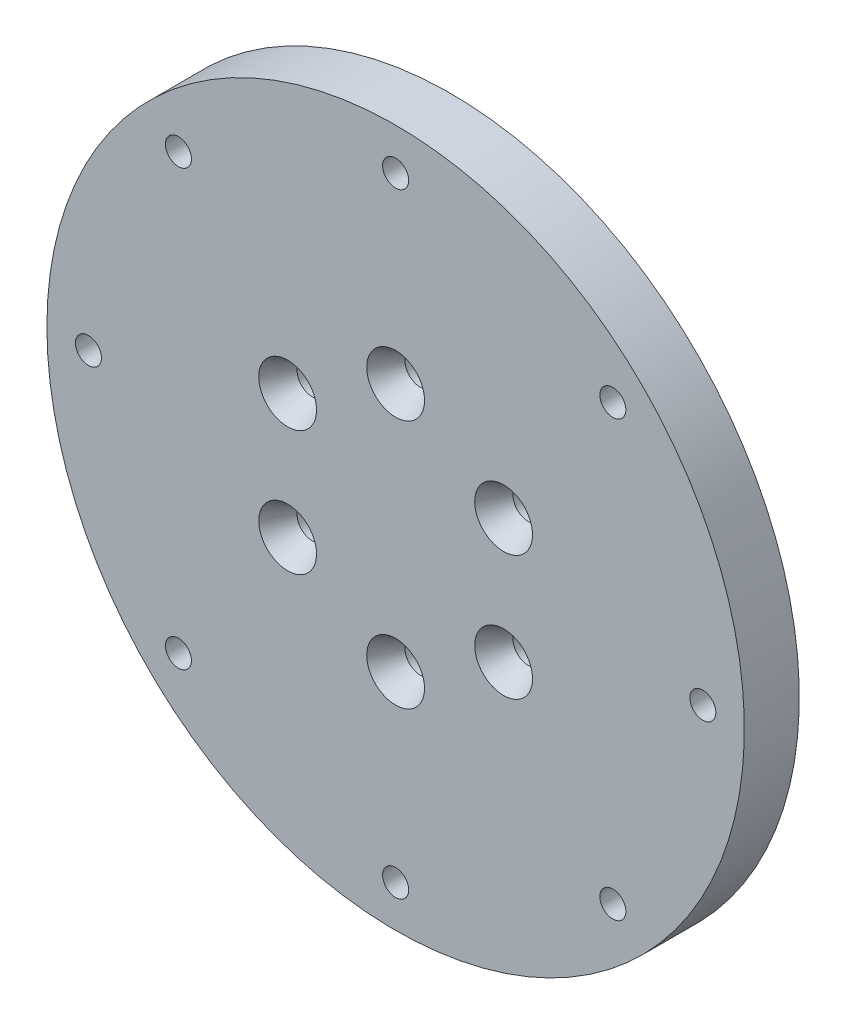
from build123d import *

# Parameters (mm, degrees)
SKETCH_1_R               = 29.5
EXTRUDE_1_DEPTH          = 12
SKETCH_2_R               = 48.25
EXTRUDE_2_DEPTH          = 7.6
FILLET_1_R               = 5
SKETCH_4_R               = 3
CUT_EXTRUDE_1_DEPTH      = 3.6
SKETCH_5_R               = 2.1
CUT_EXTRUDE_2_DEPTH      = 45.6
PATTERN_CIRCULAR_1_COUNT = 6
SKETCH_7_R               = 1.8
CUT_EXTRUDE_3_DEPTH      = 45.6


with BuildPart() as part:
    # 草图1 → 凸台-拉伸1 (new body)
    with BuildSketch(Plane.XY):
        Circle(SKETCH_1_R)
    extrude(amount=EXTRUDE_1_DEPTH)

    # 草图2 → 凸台-拉伸2 (add)
    with BuildSketch(Plane.XY.offset(12)):
        Circle(SKETCH_2_R)
    extrude(amount=EXTRUDE_2_DEPTH)

    # 圆角1
    fillet_1_edges = [part.edges().sort_by_distance(p)[0] for p in [
        (-29.5, 0, 12),
    ]]
    fillet(fillet_1_edges, radius=FILLET_1_R)

    # 草图4 → 切除-拉伸1 (cut)
    with BuildSketch(Plane(origin=(0, 0, 12), x_dir=(-1, 0, 0), z_dir=(0, 0, -1))):
        with Locations((0, 42.5)):
            Circle(SKETCH_4_R)
        with Locations((30.0520382, 30.0520382)):
            Circle(SKETCH_4_R)
        with Locations((42.5, 0)):
            Circle(SKETCH_4_R)
        with Locations((30.0520382, -30.0520382)):
            Circle(SKETCH_4_R)
        with Locations((0, -42.5)):
            Circle(SKETCH_4_R)
        with Locations((-30.0520382, -30.0520382)):
            Circle(SKETCH_4_R)
        with Locations((-42.5, 0)):
            Circle(SKETCH_4_R)
        with Locations((-30.0520382, 30.0520382)):
            Circle(SKETCH_4_R)
    extrude(amount=-CUT_EXTRUDE_1_DEPTH, mode=Mode.SUBTRACT)

    # 草图5 → 切除-拉伸2 (cut)
    with BuildSketch(Plane.XY.offset(19.6)):
        with Locations((14.938938215, 8.625)):
            Circle(SKETCH_5_R)
        with Locations((14.938938215, -8.625)):
            Circle(SKETCH_5_R)
        with Locations((0, 17.25)):
            Circle(SKETCH_5_R)
        with Locations((0, -17.25)):
            Circle(SKETCH_5_R)
        with Locations((-14.938938215, 8.625)):
            Circle(SKETCH_5_R)
        with Locations((-14.938938215, -8.625)):
            Circle(SKETCH_5_R)
    extrude(amount=-CUT_EXTRUDE_2_DEPTH, mode=Mode.SUBTRACT)

    # 草图6 → 切除-旋转1 (revolve, cut)
    with BuildSketch(Plane(origin=(7.469469108, 12.9375, 0), x_dir=(0.8660254037844382, -0.500000000000001, 0), z_dir=(0.5000000000000009, 0.866025403784438, 0))):
        Polygon((8.625, -16.2), (8.625, -19.6), (10.725, -19.6), (12.625, -19.6), (10.725, -16.2), align=None)
    cut_revolve_1 = revolve(axis=Axis((14.938938215, 8.625, 0), (0, 0, 1)), mode=Mode.SUBTRACT)

    # 阵列(圆周)1: 切除-旋转1 ×6 about axis
    pattern_circular_1_axis = Axis((0, 0, 19.6), (0, 0, 1))
    for i in range(1, PATTERN_CIRCULAR_1_COUNT):
        add(cut_revolve_1.rotate(pattern_circular_1_axis, i * 360 / PATTERN_CIRCULAR_1_COUNT), mode=Mode.SUBTRACT)

    # 草图7 → 切除-拉伸3 (cut)
    with BuildSketch(Plane(origin=(0, 0, 15.6), x_dir=(-1, 0, 0), z_dir=(0, 0, -1))):
        with Locations((0, 42.5)):
            Circle(SKETCH_7_R)
        with Locations((30.0520382, 30.0520382)):
            Circle(SKETCH_7_R)
        with Locations((42.5, 0)):
            Circle(SKETCH_7_R)
        with Locations((30.0520382, -30.0520382)):
            Circle(SKETCH_7_R)
        with Locations((0, -42.5)):
            Circle(SKETCH_7_R)
        with Locations((-30.0520382, -30.0520382)):
            Circle(SKETCH_7_R)
        with Locations((-42.5, 0)):
            Circle(SKETCH_7_R)
        with Locations((-30.0520382, 30.0520382)):
            Circle(SKETCH_7_R)
    extrude(amount=-CUT_EXTRUDE_3_DEPTH, mode=Mode.SUBTRACT)


solid = part.part
